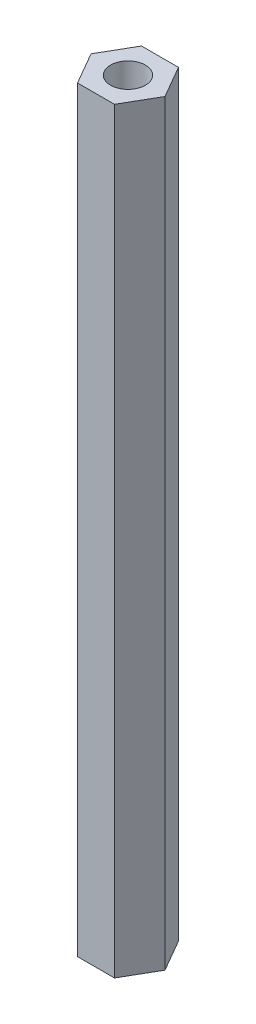
from build123d import *

# Parameters (mm, degrees)
BOSS_EXTRUDE1_DEPTH = 65
SKETCH2_R           = 1.5
CUT_EXTRUDE1_DEPTH  = 10


with BuildPart() as part:
    # Sketch1 → Boss-Extrude1 (new body)
    with BuildSketch(Plane(origin=(0, 0, 0), x_dir=(1, 0, 0), z_dir=(0, 1, 0))):
        Polygon((3.175426481, 0), (1.58771324, 2.75), (-1.58771324, 2.75), (-3.175426481, 0), (-1.58771324, -2.75), (1.58771324, -2.75), align=None)
    extrude(amount=BOSS_EXTRUDE1_DEPTH)

    # Sketch2 → Cut-Extrude1 (cut)
    with BuildSketch(Plane(origin=(0, 65, 0), x_dir=(1, 0, 0), z_dir=(0, 1, 0))):
        with Locations(Location((0, 0, 0), (0, 0, 270))):
            Circle(SKETCH2_R)
    cut_extrude1 = extrude(amount=-CUT_EXTRUDE1_DEPTH, mode=Mode.SUBTRACT)

    # Mirror1: Cut-Extrude1 across plane
    add(cut_extrude1.mirror(Plane(origin=(0, 32.5, 0), x_dir=(0, 0, 1), z_dir=(0, -1, 0))), mode=Mode.SUBTRACT)


solid = part.part
